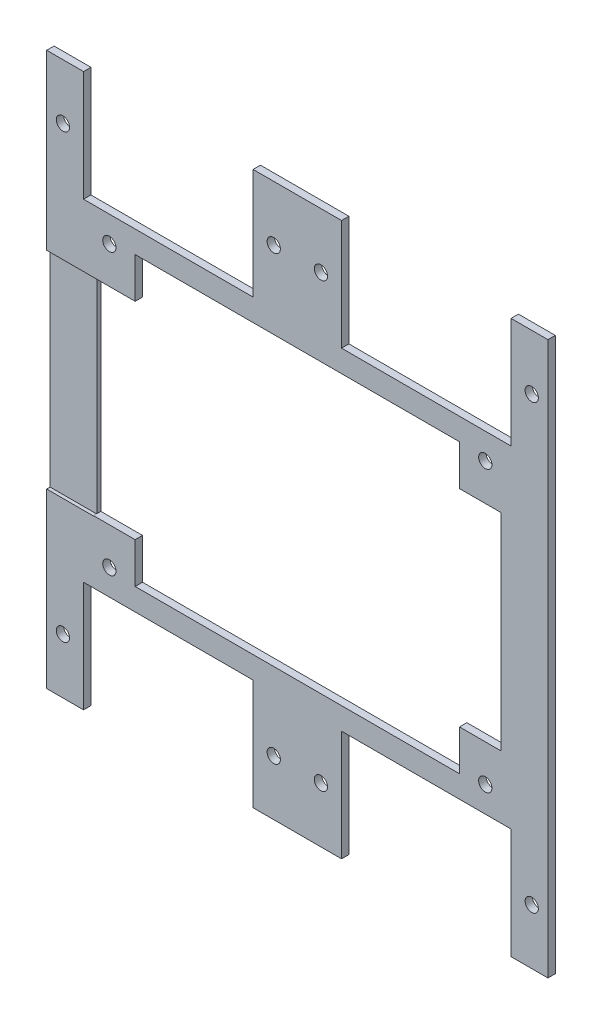
from build123d import *

# Parameters (mm, degrees)
SKETCH2_W           = 680
SKETCH2_H           = 750
BOSS_EXTRUDE1_DEPTH = 10
SKETCH3_W           = 230
SKETCH3_H           = 150
CUT_EXTRUDE1_DEPTH  = 507.285492583
SKETCH4_R           = 9
CUT_EXTRUDE4_DEPTH  = 507.285492583
SKETCH6_W           = 440
SKETCH6_H           = 280
SKETCH6_H_2         = 55
SKETCH6_W_2         = 56.5
CUT_EXTRUDE6_DEPTH  = 507.285492583
SKETCH7_W           = 63.5
SKETCH7_H           = 280.49751631
CUT_EXTRUDE7_DEPTH  = 4.6


with BuildPart() as part:
    # Sketch2 → Boss-Extrude1 (new body)
    with BuildSketch(Plane.XY):
        Rectangle(SKETCH2_W, SKETCH2_H)
    extrude(amount=BOSS_EXTRUDE1_DEPTH)

    # Sketch3 → Cut-Extrude1 (cut, through all)
    with BuildSketch(Plane.XY.offset(10)):
        with Locations((-175, 300)):
            Rectangle(SKETCH3_W, SKETCH3_H)
        with Locations((175, 300)):
            Rectangle(SKETCH3_W, SKETCH3_H)
        with Locations((175, -300)):
            Rectangle(SKETCH3_W, SKETCH3_H)
        with Locations((-175, -300)):
            Rectangle(SKETCH3_W, SKETCH3_H)
    extrude(amount=-CUT_EXTRUDE1_DEPTH, mode=Mode.SUBTRACT)

    # Sketch4 → Cut-Extrude4 (cut, through all)
    with BuildSketch(Plane.XY.offset(10)):
        with Locations((-318, 300)):
            Circle(SKETCH4_R)
        with Locations((-32, 300)):
            Circle(SKETCH4_R)
        with Locations((-255, 190)):
            Circle(SKETCH4_R)
        with Locations(Location((318, 300, 0), (0, 0, 180))):
            Circle(SKETCH4_R)
        with Locations(Location((255, 190, 0), (0, 0, 180))):
            Circle(SKETCH4_R)
        with Locations(Location((32, 300, 0), (0, 0, 180))):
            Circle(SKETCH4_R)
        with Locations((318, -300)):
            Circle(SKETCH4_R)
        with Locations((255, -190)):
            Circle(SKETCH4_R)
        with Locations((32, -300)):
            Circle(SKETCH4_R)
        with Locations(Location((-255, -190, 0), (0, 0, 180))):
            Circle(SKETCH4_R)
        with Locations(Location((-32, -300, 0), (0, 0, 180))):
            Circle(SKETCH4_R)
        with Locations(Location((-318, -300, 0), (0, 0, 180))):
            Circle(SKETCH4_R)
    extrude(amount=-CUT_EXTRUDE4_DEPTH, mode=Mode.SUBTRACT)

    # Sketch6 → Cut-Extrude6 (cut, through all)
    with BuildSketch(Plane.XY.offset(10)):
        Rectangle(SKETCH6_W, SKETCH6_H)
        with Locations((0, 167.5)):
            Rectangle(SKETCH6_W, SKETCH6_H_2)
        with Locations((0, -167.5)):
            Rectangle(SKETCH6_W, SKETCH6_H_2)
        with Locations((248.25, 0)):
            Rectangle(SKETCH6_W_2, SKETCH6_H)
        with Locations((-248.25, 0)):
            Rectangle(SKETCH6_W_2, SKETCH6_H)
    extrude(amount=-CUT_EXTRUDE6_DEPTH, mode=Mode.SUBTRACT)

    # Sketch7 → Cut-Extrude7 (cut)
    with BuildSketch(Plane.XY.offset(10)):
        with Locations((-308.25, -0.248758155)):
            Rectangle(SKETCH7_W, SKETCH7_H)
    extrude(amount=-CUT_EXTRUDE7_DEPTH, mode=Mode.SUBTRACT)


solid = part.part
